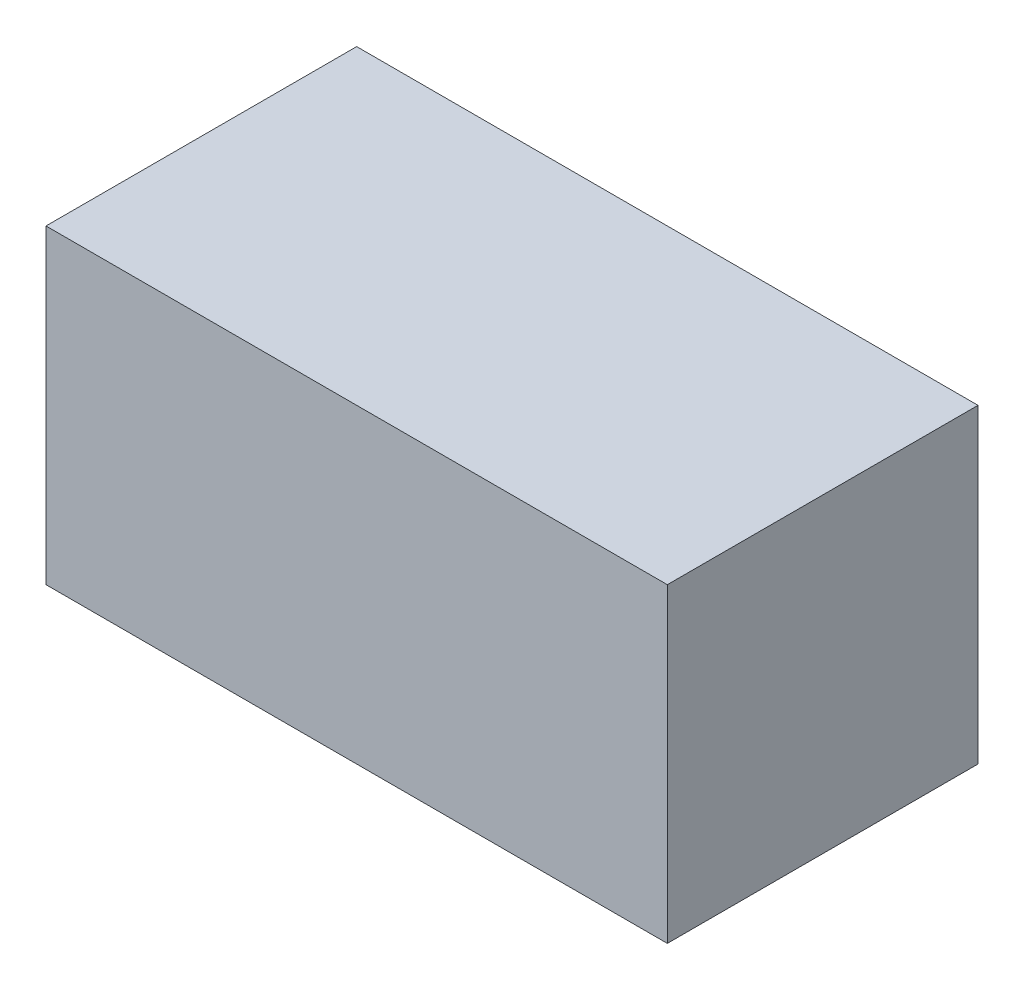
from build123d import *

# Parameters (mm, degrees)
SKETCH_1_W      = 2
SKETCH_1_H      = 1
EXTRUDE_1_DEPTH = 1


with BuildPart() as part:
    # 草图1 → 凸台-拉伸1 (new body)
    with BuildSketch(Plane.XY):
        with Locations((-1.010243083, 1.5477984)):
            Rectangle(SKETCH_1_W, SKETCH_1_H)
    extrude(amount=EXTRUDE_1_DEPTH)


solid = part.part
